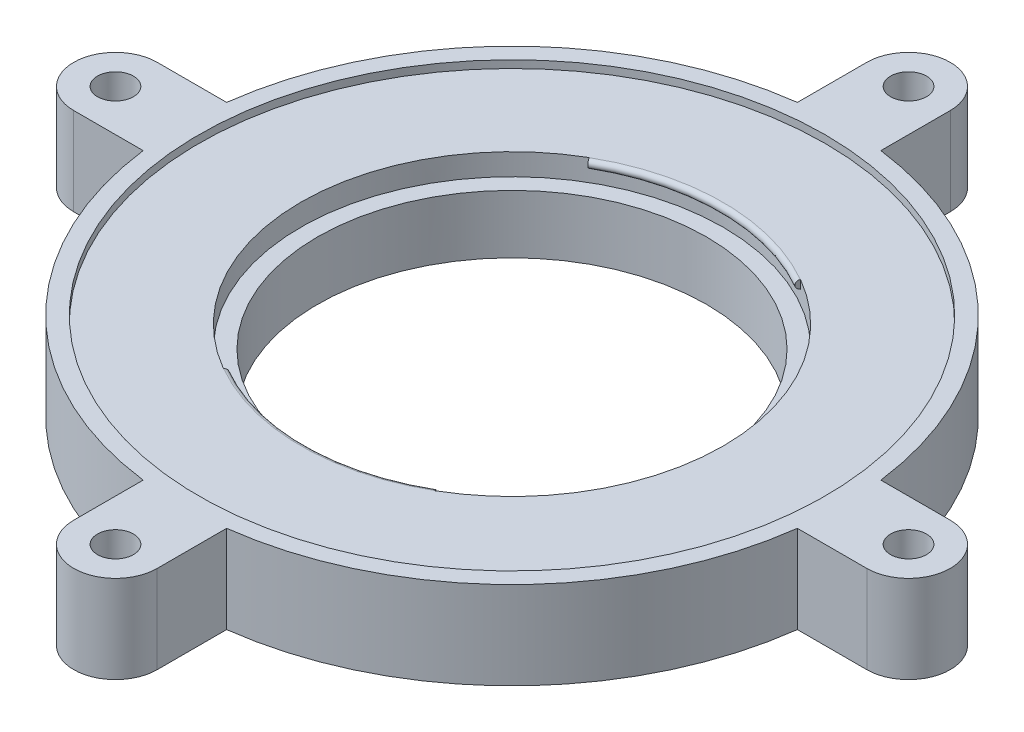
from build123d import *

# Parameters (mm, degrees)
SKETCH2_R           = 2.15
BOSS_EXTRUDE1_DEPTH = 10.507214
CUT_EXTRUDE2_REACH  = 76.575
SKETCH4_R           = 2.15
CUT_EXTRUDE3_DEPTH  = 7
BOSS_EXTRUDE2_START = -7
SKETCH5_R           = 24.3
SKETCH5_R_2         = 23.3
BOSS_EXTRUDE2_DEPTH = 7
SKETCH6_R           = 23.3
CUT_EXTRUDE4_DEPTH  = 75.575465
CUT_EXTRUDE5_DEPTH  = 75.575465


with BuildPart() as part:
    # Sketch1 → Revolve1 (revolve)
    with BuildSketch(Plane(origin=(0, 0, 0), x_dir=(0, 0, -1), z_dir=(1, 0, 0)), mode=Mode.PRIVATE) as revolve1_sk:
        with BuildLine():
            Line((-37.5, -1.048229), (-37.5, -1.955443))
            Line((-37.5, -1.955443), (-25.283016, -1.955443))
            ThreePointArc((-25.283016, -1.955443), (-24.8, -2.421893), (-25.216498, -2.94859))
            ThreePointArc((-25.216498, -2.94859), (-25.276321, -2.982605), (-25.3, -3.04722))
            Line((-25.3, -3.04722), (-25.3, -4.555443))
            Line((-25.3, -4.555443), (-8, -4.555443))
            Line((-8, -4.555443), (-8, -11.555443))
            Line((-8, -11.555443), (-39.5, -11.555443))
            Line((-39.5, -11.555443), (-39.5, -1.048229))
            Line((-39.5, -1.048229), (-37.5, -1.048229))
        make_face()
    revolve(revolve1_sk.sketch.rotate(Axis((0, -1000, 0), (0, 1, 0)), 180), axis=Axis((0, -1000, 0), (0, 1, 0)))

    # Sketch2 → Boss-Extrude1 (add)
    # profile 1 of 4: a face of its own
    with BuildSketch(Plane.XZ.offset(11.555443)):
        with BuildLine():
            Line((-5, 47.5), (-5, 39.182266))
            Line((-5, 39.182266), (5, 39.182266))
            Line((5, 39.182266), (5, 47.5))
            ThreePointArc((5, 47.5), (0, 52.5), (-5, 47.5))
        make_face()
        with Locations(Location((0, 47.5, 0), (0, 0, 270))):
            Circle(SKETCH2_R, mode=Mode.SUBTRACT)
    # profile 2 of 4: a face of its own
    with BuildSketch(Plane.XZ.offset(11.555443)):
        with BuildLine():
            Line((47.5, -5), (39.182266, -5))
            Line((39.182266, -5), (39.182266, 5))
            Line((39.182266, 5), (47.5, 5))
            ThreePointArc((47.5, 5), (52.5, 0), (47.5, -5))
        make_face()
        with Locations(Location((47.5, 0, 0), (0, 0, 270))):
            Circle(SKETCH2_R, mode=Mode.SUBTRACT)
    # profile 3 of 4: a face of its own
    with BuildSketch(Plane.XZ.offset(11.555443)):
        with BuildLine():
            Line((-5, -47.5), (-5, -39.182266))
            Line((-5, -39.182266), (5, -39.182266))
            Line((5, -39.182266), (5, -47.5))
            ThreePointArc((5, -47.5), (0, -52.5), (-5, -47.5))
        make_face()
        with Locations(Location((0, -47.5, 0), (0, 0, 270))):
            Circle(SKETCH2_R, mode=Mode.SUBTRACT)
    # profile 4 of 4: a face of its own
    with BuildSketch(Plane.XZ.offset(11.555443)):
        with BuildLine():
            Line((-47.5, 5), (-39.182266, 5))
            Line((-39.182266, 5), (-39.182266, -5))
            Line((-39.182266, -5), (-47.5, -5))
            ThreePointArc((-47.5, -5), (-52.5, 0), (-47.5, 5))
        make_face()
        with Locations(Location((-47.5, 0, 0), (0, 0, 270))):
            Circle(SKETCH2_R, mode=Mode.SUBTRACT)
    extrude(amount=-BOSS_EXTRUDE1_DEPTH)

    # Sketch3 → Cut-Extrude2 (cut, up to next)
    with BuildSketch(Plane(origin=(0, -4.555443, 0), x_dir=(1, 0, 0), z_dir=(0, 1, 0)), mode=Mode.PRIVATE) as cut_extrude2_sk1:
        with BuildLine():
            Line((21.938323, -2), (12.369317, -2))
            ThreePointArc((12.369317, -2), (11.19262, -2.382785), (10.466345, -3.384615))
            ThreePointArc((10.466345, -3.384615), (7.778175, -7.778175), (3.384615, -10.466345))
            ThreePointArc((3.384615, -10.466345), (2.382785, -11.19262), (2, -12.369317))
            Line((2, -12.369317), (2, -21.938323))
            ThreePointArc((2, -21.938323), (2.718885, -23.474143), (4.358744, -23.905885))
            ThreePointArc((4.358744, -23.905885), (17.182695, -17.182695), (23.905885, -4.358744))
            ThreePointArc((23.905885, -4.358744), (23.474143, -2.718885), (21.938323, -2))
        make_face()
    cut_extrude2_tool1 = extrude(cut_extrude2_sk1.sketch, amount=-CUT_EXTRUDE2_REACH, mode=Mode.PRIVATE) & part.part
    # Sketch3 → Cut-Extrude2 (cut, up to next)
    with BuildSketch(Plane(origin=(0, -4.555443, 0), x_dir=(1, 0, 0), z_dir=(0, 1, 0)), mode=Mode.PRIVATE) as cut_extrude2_sk2:
        with BuildLine():
            Line((-2, -21.938323), (-2, -12.369317))
            ThreePointArc((-2, -12.369317), (-2.382785, -11.19262), (-3.384615, -10.466345))
            ThreePointArc((-3.384615, -10.466345), (-7.778175, -7.778175), (-10.466345, -3.384615))
            ThreePointArc((-10.466345, -3.384615), (-11.19262, -2.382785), (-12.369317, -2))
            Line((-12.369317, -2), (-21.938323, -2))
            ThreePointArc((-21.938323, -2), (-23.474143, -2.718885), (-23.905885, -4.358744))
            ThreePointArc((-23.905885, -4.358744), (-17.182695, -17.182695), (-4.358744, -23.905885))
            ThreePointArc((-4.358744, -23.905885), (-2.718885, -23.474143), (-2, -21.938323))
        make_face()
    cut_extrude2_tool2 = extrude(cut_extrude2_sk2.sketch, amount=-CUT_EXTRUDE2_REACH, mode=Mode.PRIVATE) & part.part
    # Sketch3 → Cut-Extrude2 (cut, up to next)
    with BuildSketch(Plane(origin=(0, -4.555443, 0), x_dir=(1, 0, 0), z_dir=(0, 1, 0)), mode=Mode.PRIVATE) as cut_extrude2_sk3:
        with BuildLine():
            Line((-21.938323, 2), (-12.369317, 2))
            ThreePointArc((-12.369317, 2), (-11.19262, 2.382785), (-10.466345, 3.384615))
            ThreePointArc((-10.466345, 3.384615), (-7.778175, 7.778175), (-3.384615, 10.466345))
            ThreePointArc((-3.384615, 10.466345), (-2.382785, 11.19262), (-2, 12.369317))
            Line((-2, 12.369317), (-2, 21.938323))
            ThreePointArc((-2, 21.938323), (-2.718885, 23.474143), (-4.358744, 23.905885))
            ThreePointArc((-4.358744, 23.905885), (-17.182695, 17.182695), (-23.905885, 4.358744))
            ThreePointArc((-23.905885, 4.358744), (-23.474143, 2.718885), (-21.938323, 2))
        make_face()
    cut_extrude2_tool3 = extrude(cut_extrude2_sk3.sketch, amount=-CUT_EXTRUDE2_REACH, mode=Mode.PRIVATE) & part.part
    # Sketch3 → Cut-Extrude2 (cut, up to next)
    with BuildSketch(Plane(origin=(0, -4.555443, 0), x_dir=(1, 0, 0), z_dir=(0, 1, 0)), mode=Mode.PRIVATE) as cut_extrude2_sk4:
        with BuildLine():
            Line((2, 21.938323), (2, 12.369317))
            ThreePointArc((2, 12.369317), (2.382785, 11.19262), (3.384615, 10.466345))
            ThreePointArc((3.384615, 10.466345), (7.778175, 7.778175), (10.466345, 3.384615))
            ThreePointArc((10.466345, 3.384615), (11.19262, 2.382785), (12.369317, 2))
            Line((12.369317, 2), (21.938323, 2))
            ThreePointArc((21.938323, 2), (23.474143, 2.718885), (23.905885, 4.358744))
            ThreePointArc((23.905885, 4.358744), (17.182695, 17.182695), (4.358744, 23.905885))
            ThreePointArc((4.358744, 23.905885), (2.718885, 23.474143), (2, 21.938323))
        make_face()
    cut_extrude2_tool4 = extrude(cut_extrude2_sk4.sketch, amount=-CUT_EXTRUDE2_REACH, mode=Mode.PRIVATE) & part.part
    add(cut_extrude2_tool1.solids().sort_by_distance((12.193258, -4.555443, 12.193258))[0], mode=Mode.SUBTRACT)
    add(cut_extrude2_tool2.solids().sort_by_distance((-12.193258, -4.555443, 12.193258))[0], mode=Mode.SUBTRACT)
    add(cut_extrude2_tool3.solids().sort_by_distance((-12.193258, -4.555443, -12.193258))[0], mode=Mode.SUBTRACT)
    add(cut_extrude2_tool4.solids().sort_by_distance((12.193258, -4.555443, -12.193258))[0], mode=Mode.SUBTRACT)

    # Sketch4 → Cut-Extrude3 (cut)
    with BuildSketch(Plane(origin=(0, -11.555443, 0), x_dir=(-1, 0, 0), z_dir=(0, -1, 0))):
        with Locations(Location((30, 0, 0), (0, 0, 90))):
            Circle(SKETCH4_R)
        with Locations(Location((0, -30, 0), (0, 0, 90))):
            Circle(SKETCH4_R)
        with Locations(Location((-30, 0, 0), (0, 0, 90))):
            Circle(SKETCH4_R)
        with Locations(Location((0, 30, 0), (0, 0, 90))):
            Circle(SKETCH4_R)
    extrude(amount=-CUT_EXTRUDE3_DEPTH, mode=Mode.SUBTRACT)

    # Sketch5 → Boss-Extrude2 (add)
    with BuildSketch(Plane.XZ.offset(11.555443).offset(BOSS_EXTRUDE2_START)):
        Circle(SKETCH5_R)
        Circle(SKETCH5_R_2, mode=Mode.SUBTRACT)
    extrude(amount=BOSS_EXTRUDE2_DEPTH)

    # Sketch6 → Cut-Extrude4 (cut, through all)
    with BuildSketch(Plane(origin=(0, -4.555443, 0), x_dir=(1, 0, 0), z_dir=(0, 1, 0))):
        with Locations(Location((0, 0, 0), (0, 0, 90))):
            Circle(SKETCH6_R)
    extrude(amount=-CUT_EXTRUDE4_DEPTH, mode=Mode.SUBTRACT)

    # Sketch7 → Cut-Extrude5 (cut, through all)
    with BuildSketch(Plane(origin=(0, -4.555443, 0), x_dir=(1, 0, 0), z_dir=(0, 1, 0))):
        with BuildLine():
            Line((11.65, 20.178392), (0, 0))
            Line((0, 0), (11.65, -20.178392))
            ThreePointArc((11.65, -20.178392), (20.178392, -11.65), (23.3, 0))
            ThreePointArc((23.3, 0), (20.178392, 11.65), (11.65, 20.178392))
        make_face()
        with BuildLine():
            Line((-11.65, -20.178392), (0, 0))
            Line((0, 0), (-11.65, 20.178392))
            ThreePointArc((-11.65, 20.178392), (-23.3, 0), (-11.65, -20.178392))
        make_face()
        with BuildLine():
            ThreePointArc((23.3, 0), (20.178392, -11.65), (11.65, -20.178392))
            Line((11.65, -20.178392), (12.65, -21.910443))
            ThreePointArc((12.65, -21.910443), (21.910443, -12.65), (25.3, 0))
            ThreePointArc((25.3, 0), (21.910443, 12.65), (12.65, 21.910443))
            Line((12.65, 21.910443), (11.65, 20.178392))
            ThreePointArc((11.65, 20.178392), (20.178392, 11.65), (23.3, 0))
        make_face()
        with BuildLine():
            Line((-12.65, -21.910443), (-11.65, -20.178392))
            ThreePointArc((-11.65, -20.178392), (-23.3, 0), (-11.65, 20.178392))
            Line((-11.65, 20.178392), (-12.65, 21.910443))
            ThreePointArc((-12.65, 21.910443), (-25.3, 0), (-12.65, -21.910443))
        make_face()
    extrude(amount=CUT_EXTRUDE5_DEPTH, mode=Mode.SUBTRACT)


solid = part.part
